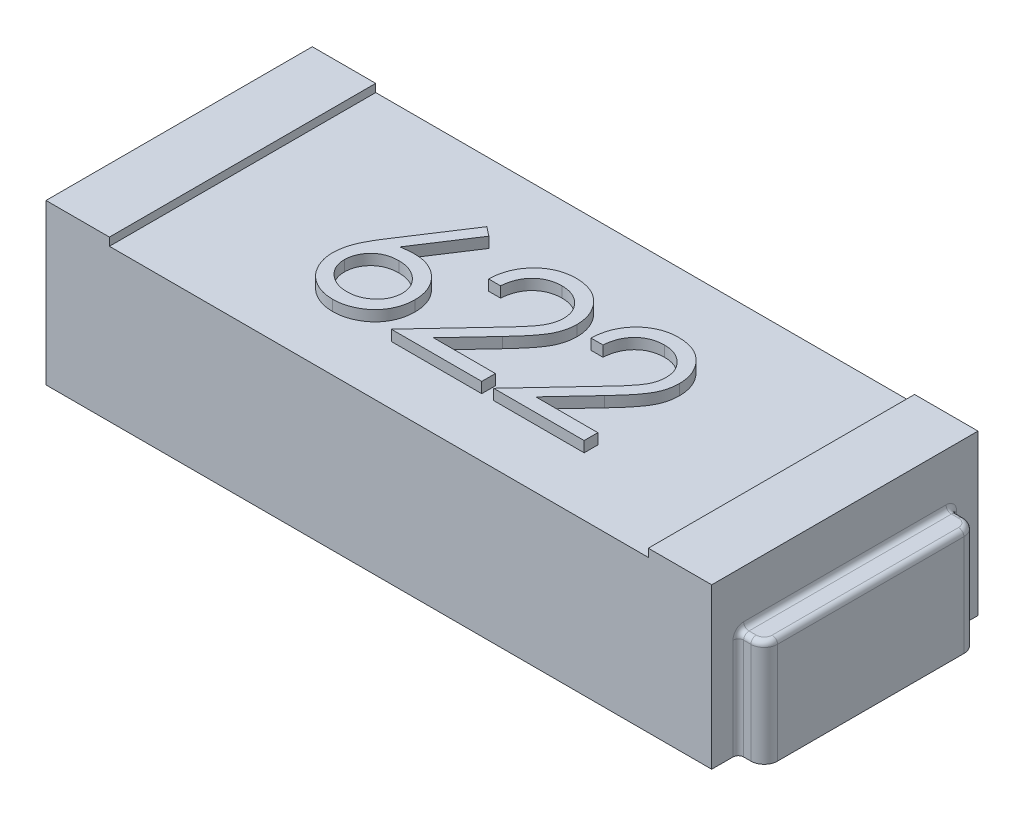
from build123d import *

# Parameters (mm, degrees)
ESQUISSE1_W             = 2.5
ESQUISSE1_H             = 1
BOSS_EXTRU_1_DEPTH      = 0.6
ESQUISSE2_W             = 2.023603034
ESQUISSE2_H             = 1
ENL_V_MAT_EXTRU_1_DEPTH = 0.03
BOSS_EXTRU_2_DEPTH      = 0.4
CONG_1_R                = 0.02
CONG_1_OF_SYM_TRIE2_R   = 0.02
BOSS_EXTRU_3_DEPTH      = 0.04


with BuildPart() as part:
    # Esquisse1 → Boss.-Extru.1 (new body)
    with BuildSketch(Plane(origin=(0, 0, 0), x_dir=(1, 0, 0), z_dir=(0, 1, 0))):
        Rectangle(ESQUISSE1_W, ESQUISSE1_H)
    extrude(amount=BOSS_EXTRU_1_DEPTH)

    # Esquisse2 → Enlèv. mat.-Extru.1 (cut)
    with BuildSketch(Plane(origin=(0, 0.6, 0), x_dir=(1, 0, 0), z_dir=(0, 1, 0))):
        Rectangle(ESQUISSE2_W, ESQUISSE2_H)
    extrude(amount=-ENL_V_MAT_EXTRU_1_DEPTH, mode=Mode.SUBTRACT)

    # Esquisse3 → Boss.-Extru.2 (add)
    with BuildSketch(Plane(origin=(0, 0, 0), x_dir=(1, 0, 0), z_dir=(0, 1, 0))):
        with BuildLine():
            Line((1.25, 0.4), (1.297141448, 0.4))
            ThreePointArc((1.297141448, 0.4), (1.332496787, 0.385355339), (1.347141448, 0.35))
            Line((1.347141448, 0.35), (1.347141448, -0.35))
            ThreePointArc((1.347141448, -0.35), (1.332496787, -0.385355339), (1.297141448, -0.4))
            Line((1.297141448, -0.4), (1.25, -0.4))
            Line((1.25, -0.4), (1.25, 0.4))
        make_face()
    boss_extru_2 = extrude(amount=BOSS_EXTRU_2_DEPTH)

    # Congé1
    cong_1_edges = [part.edges().sort_by_distance(p)[0] for p in [
        (1.25, 0.2, -0.4),
        (1.25, 0.2, 0.4),
        (1.25, 0.4, 0),
        (1.273570724, 0.4, 0.4),
        (1.332496787, 0.4, 0.385355339),
        (1.347141448, 0.4, 0),
        (1.332496787, 0.4, -0.385355339),
        (1.273570724, 0.4, -0.4),
    ]]
    fillet(cong_1_edges, radius=CONG_1_R)

    # Symétrie2: Boss.-Extru.2 across plane
    add(boss_extru_2.mirror(Plane(origin=(0, 0, 0), x_dir=(0, 0, 1), z_dir=(1, 0, 0))))

    # Congé1 of Symétrie2
    cong_1_of_sym_trie2_edges = [part.edges().sort_by_distance(p)[0] for p in [
        (-1.25, 0.2, -0.4),
        (-1.25, 0.2, 0.4),
        (-1.25, 0.4, 0),
        (-1.273570724, 0.4, 0.4),
        (-1.332496787, 0.4, 0.385355339),
        (-1.347141448, 0.4, 0),
        (-1.332496787, 0.4, -0.385355339),
        (-1.273570724, 0.4, -0.4),
    ]]
    fillet(cong_1_of_sym_trie2_edges, radius=CONG_1_OF_SYM_TRIE2_R)

    # Esquisse4 → Boss.-Extru.3 (add)
    # profile 1 of 3: a face of its own
    with BuildSketch(Plane(origin=(0, 0.57, 0), x_dir=(1, 0, 0), z_dir=(0, 1, 0))):
        with BuildLine():
            Line((0.275641026, 0.065854324), (0.230769231, 0.065854324))
            add(Edge.make_bspline(
                [(0.230769231, 0.065854324), (0.231061681, 0.071807307), (0.231636046, 0.08349881), (0.234325802, 0.100545082), (0.238174498, 0.116838625), (0.243616135, 0.132248612), (0.250374174, 0.146911299), (0.258478464, 0.160768444), (0.268077586, 0.173767185), (0.278964262, 0.18578702), (0.290788353, 0.196813816), (0.303546344, 0.206335994), (0.316952777, 0.214381375), (0.330966977, 0.221107267), (0.345747057, 0.226155816), (0.361158894, 0.229901765), (0.377270199, 0.232155528), (0.388247345, 0.232397784), (0.393830128, 0.23252099)],
                knots=[0, 0, 0, 0, 1.10065271, 2.161652631, 3.183658789, 4.190468796, 5.17591951, 6.163126047, 7.15150782, 8.156236427, 9.156009102, 10.134482811, 11.092018607, 12.041330605, 13.001268258, 13.972401359, 14.968799086, 16, 16, 16, 16], degree=3))
            add(Edge.make_bspline(
                [(0.393830128, 0.23252099), (0.39931271, 0.232392639), (0.410085788, 0.232140434), (0.425808933, 0.229974573), (0.440777118, 0.226582346), (0.454961085, 0.221823), (0.468247665, 0.215425225), (0.480736672, 0.207739862), (0.492576787, 0.198851315), (0.503234899, 0.188386485), (0.513021768, 0.177214715), (0.521464947, 0.165287872), (0.528695399, 0.152969403), (0.53472221, 0.140165374), (0.539158802, 0.126755227), (0.542527117, 0.112934198), (0.544431033, 0.098559225), (0.544723237, 0.088829717), (0.544871795, 0.08388317)],
                knots=[0, 0, 0, 0, 1.111607364, 2.184268762, 3.212621178, 4.221274766, 5.211760367, 6.196651075, 7.1921475, 8.207485113, 9.220403448, 10.201281604, 11.166441695, 12.114753415, 13.065576456, 14.026450734, 14.996634279, 16, 16, 16, 16], degree=3))
            add(Edge.make_bspline(
                [(0.544871795, 0.08388317), (0.5446299, 0.076919193), (0.544150356, 0.063113449), (0.540048302, 0.042825611), (0.533641657, 0.023169408), (0.525927749, 0.007349794), (0.518145972, -0.005397848), (0.511133471, -0.015893378), (0.502924212, -0.027194159), (0.493398712, -0.03926235), (0.482754016, -0.052192479), (0.470893707, -0.065976736), (0.45773321, -0.080472703), (0.448496281, -0.090373503), (0.443709936, -0.09550385)],
                knots=[0, 0, 0, 0, 1.184426356, 2.348067706, 3.509069118, 4.696110526, 5.333549288, 6.050745305, 6.844228056, 7.710549037, 8.667450064, 9.695053472, 10.805634456, 12, 12, 12, 12], degree=3))
            Line((0.443709936, -0.09550385), (0.318609776, -0.229017471))
            Line((0.318609776, -0.229017471), (0.551282051, -0.229017471))
            Line((0.551282051, -0.229017471), (0.551282051, -0.280299523))
            Line((0.551282051, -0.280299523), (0.211538462, -0.280299523))
            Line((0.211538462, -0.280299523), (0.405448718, -0.073368433))
            add(Edge.make_bspline(
                [(0.405448718, -0.073368433), (0.410169845, -0.068440103), (0.419238163, -0.058973791), (0.432064245, -0.045153368), (0.443584101, -0.032332005), (0.4538723, -0.020533927), (0.462705658, -0.00958656), (0.470544548, 0.000155541), (0.476825347, 0.009120462), (0.483641832, 0.019511978), (0.490243829, 0.032199452), (0.495917023, 0.047704265), (0.499376287, 0.063665301), (0.499791263, 0.074451306), (0.5, 0.079876759)],
                knots=[0, 0, 0, 0, 1.329631726, 2.553950428, 3.673215718, 4.687767853, 5.603093632, 6.413772471, 7.123043292, 7.734684054, 8.834405432, 9.900288307, 10.943827018, 12, 12, 12, 12], degree=3))
            add(Edge.make_bspline(
                [(0.5, 0.079876759), (0.49990918, 0.083288388), (0.49973019, 0.090012052), (0.498150519, 0.099870018), (0.495763304, 0.109379277), (0.492342553, 0.11856908), (0.487827304, 0.12734703), (0.482331107, 0.135723813), (0.47598967, 0.143822236), (0.468653774, 0.151415565), (0.460594985, 0.158370023), (0.452081521, 0.164530606), (0.443074363, 0.169679051), (0.433611489, 0.17389955), (0.423719279, 0.177210319), (0.413378601, 0.179504402), (0.402618027, 0.180944757), (0.395270385, 0.181139638), (0.391526442, 0.181238939)],
                knots=[0, 0, 0, 0, 0.991446411, 1.95395049, 2.89581595, 3.838931463, 4.798493298, 5.75982156, 6.748411868, 7.785213223, 8.824556874, 9.840280684, 10.836137867, 11.835679398, 12.848801643, 13.863922112, 14.911575587, 16, 16, 16, 16], degree=3))
            add(Edge.make_bspline(
                [(0.391526442, 0.181238939), (0.387616323, 0.181136791), (0.379937495, 0.180936191), (0.368663348, 0.179532953), (0.357908237, 0.177112119), (0.347645108, 0.173801165), (0.337856595, 0.169592801), (0.328590303, 0.164351123), (0.319867034, 0.158096338), (0.311670387, 0.15100483), (0.30411839, 0.143109459), (0.297483122, 0.134308036), (0.291685406, 0.124761262), (0.286626944, 0.114494898), (0.282518988, 0.103415786), (0.279379967, 0.091563257), (0.276896132, 0.078988774), (0.276066343, 0.07030519), (0.275641026, 0.065854324)],
                knots=[0, 0, 0, 0, 1.031018746, 2.02475058, 2.990194455, 3.934040569, 4.864654155, 5.795059489, 6.735614925, 7.690564532, 8.649604399, 9.611025574, 10.590972636, 11.591080095, 12.624614302, 13.701020113, 14.821632451, 16, 16, 16, 16], degree=3))
        make_face()
    # profile 2 of 3: a face of its own
    with BuildSketch(Plane(origin=(0, 0.57, 0), x_dir=(1, 0, 0), z_dir=(0, 1, 0))):
        with BuildLine():
            Line((-0.108974359, 0.065854324), (-0.153846154, 0.065854324))
            add(Edge.make_bspline(
                [(-0.153846154, 0.065854324), (-0.153553703, 0.071807307), (-0.152979339, 0.08349881), (-0.150289583, 0.100545082), (-0.146440886, 0.116838625), (-0.14099925, 0.132248612), (-0.13424121, 0.146911299), (-0.126136921, 0.160768444), (-0.116537799, 0.173767185), (-0.105651123, 0.18578702), (-0.093827032, 0.196813816), (-0.08106904, 0.206335994), (-0.067662608, 0.214381375), (-0.053648408, 0.221107267), (-0.038868327, 0.226155816), (-0.023456491, 0.229901765), (-0.007345185, 0.232155528), (0.003631961, 0.232397784), (0.009214744, 0.23252099)],
                knots=[0, 0, 0, 0, 1.10065271, 2.161652631, 3.183658789, 4.190468796, 5.17591951, 6.163126047, 7.15150782, 8.156236427, 9.156009102, 10.134482811, 11.092018607, 12.041330605, 13.001268258, 13.972401359, 14.968799086, 16, 16, 16, 16], degree=3))
            add(Edge.make_bspline(
                [(0.009214744, 0.23252099), (0.014697326, 0.232392639), (0.025470403, 0.232140434), (0.041193548, 0.229974573), (0.056161733, 0.226582346), (0.0703457, 0.221823), (0.083632281, 0.215425225), (0.096121287, 0.207739862), (0.107961403, 0.198851315), (0.118619515, 0.188386485), (0.128406383, 0.177214715), (0.136849562, 0.165287872), (0.144080014, 0.152969403), (0.150106826, 0.140165374), (0.154543417, 0.126755227), (0.157911733, 0.112934198), (0.159815649, 0.098559225), (0.160107852, 0.088829717), (0.16025641, 0.08388317)],
                knots=[0, 0, 0, 0, 1.111607364, 2.184268762, 3.212621178, 4.221274766, 5.211760367, 6.196651075, 7.1921475, 8.207485113, 9.220403448, 10.201281604, 11.166441695, 12.114753415, 13.065576456, 14.026450734, 14.996634279, 16, 16, 16, 16], degree=3))
            add(Edge.make_bspline(
                [(0.16025641, 0.08388317), (0.160014516, 0.076919193), (0.159534971, 0.063113449), (0.155432917, 0.042825611), (0.149026273, 0.023169408), (0.141312365, 0.007349794), (0.133530587, -0.005397848), (0.126518086, -0.015893378), (0.118308827, -0.027194159), (0.108783327, -0.03926235), (0.098138631, -0.052192479), (0.086278322, -0.065976736), (0.073117825, -0.080472703), (0.063880896, -0.090373503), (0.059094551, -0.09550385)],
                knots=[0, 0, 0, 0, 1.184426356, 2.348067706, 3.509069118, 4.696110526, 5.333549288, 6.050745305, 6.844228056, 7.710549037, 8.667450064, 9.695053472, 10.805634456, 12, 12, 12, 12], degree=3))
            Line((0.059094551, -0.09550385), (-0.066005609, -0.229017471))
            Line((-0.066005609, -0.229017471), (0.166666667, -0.229017471))
            Line((0.166666667, -0.229017471), (0.166666667, -0.280299523))
            Line((0.166666667, -0.280299523), (-0.173076923, -0.280299523))
            Line((-0.173076923, -0.280299523), (0.020833333, -0.073368433))
            add(Edge.make_bspline(
                [(0.020833333, -0.073368433), (0.02555446, -0.068440103), (0.034622778, -0.058973791), (0.047448861, -0.045153368), (0.058968716, -0.032332005), (0.069256915, -0.020533927), (0.078090273, -0.00958656), (0.085929163, 0.000155541), (0.092209962, 0.009120462), (0.099026447, 0.019511978), (0.105628444, 0.032199452), (0.111301638, 0.047704265), (0.114760902, 0.063665301), (0.115175879, 0.074451306), (0.115384615, 0.079876759)],
                knots=[0, 0, 0, 0, 1.329631726, 2.553950428, 3.673215718, 4.687767853, 5.603093632, 6.413772471, 7.123043292, 7.734684054, 8.834405432, 9.900288307, 10.943827018, 12, 12, 12, 12], degree=3))
            add(Edge.make_bspline(
                [(0.115384615, 0.079876759), (0.115293795, 0.083288388), (0.115114806, 0.090012052), (0.113535135, 0.099870018), (0.111147919, 0.109379277), (0.107727168, 0.11856908), (0.10321192, 0.12734703), (0.097715723, 0.135723813), (0.091374285, 0.143822236), (0.084038389, 0.151415565), (0.075979601, 0.158370023), (0.067466137, 0.164530606), (0.058458979, 0.169679051), (0.048996104, 0.17389955), (0.039103894, 0.177210319), (0.028763216, 0.179504402), (0.018002643, 0.180944757), (0.010655, 0.181139638), (0.006911058, 0.181238939)],
                knots=[0, 0, 0, 0, 0.991446411, 1.95395049, 2.89581595, 3.838931463, 4.798493298, 5.75982156, 6.748411868, 7.785213223, 8.824556874, 9.840280684, 10.836137867, 11.835679398, 12.848801643, 13.863922112, 14.911575587, 16, 16, 16, 16], degree=3))
            add(Edge.make_bspline(
                [(0.006911058, 0.181238939), (0.003000939, 0.181136791), (-0.004677889, 0.180936191), (-0.015952037, 0.179532953), (-0.026707148, 0.177112119), (-0.036970277, 0.173801165), (-0.046758789, 0.169592801), (-0.056025081, 0.164351123), (-0.064748351, 0.158096338), (-0.072944997, 0.15100483), (-0.080496994, 0.143109459), (-0.087132262, 0.134308036), (-0.092929979, 0.124761262), (-0.097988441, 0.114494898), (-0.102096396, 0.103415786), (-0.105235418, 0.091563257), (-0.107719253, 0.078988774), (-0.108549042, 0.07030519), (-0.108974359, 0.065854324)],
                knots=[0, 0, 0, 0, 1.031018746, 2.02475058, 2.990194455, 3.934040569, 4.864654155, 5.795059489, 6.735614925, 7.690564532, 8.649604399, 9.611025574, 10.590972636, 11.591080095, 12.624614302, 13.701020113, 14.821632451, 16, 16, 16, 16], degree=3))
        make_face()
    # profile 3 of 3: a face of its own
    with BuildSketch(Plane(origin=(0, 0.57, 0), x_dir=(1, 0, 0), z_dir=(0, 1, 0))):
        with BuildLine():
            Line((-0.326923077, 0.23252099), (-0.292367788, 0.205377561))
            Line((-0.292367788, 0.205377561), (-0.424479167, 0.003354324))
            add(Edge.make_bspline(
                [(-0.424479167, 0.003354324), (-0.415683413, 0.004756304), (-0.3985263, 0.007491024), (-0.381159743, 0.007942159), (-0.372696314, 0.008162016)],
                knots=[0, 0, 0, 0, 1.025318673, 2, 2, 2, 2], degree=3))
            add(Edge.make_bspline(
                [(-0.372696314, 0.008162016), (-0.367614529, 0.008025428), (-0.357611186, 0.00775656), (-0.3429245, 0.005687439), (-0.328811795, 0.002426708), (-0.315331565, -0.002326471), (-0.302435424, -0.008398236), (-0.290049368, -0.015675217), (-0.278406223, -0.024533172), (-0.267356055, -0.034428165), (-0.257323612, -0.045387735), (-0.248441319, -0.057016497), (-0.240980349, -0.069302337), (-0.234926931, -0.082239032), (-0.230226234, -0.095806641), (-0.226799428, -0.109987804), (-0.224773772, -0.124792299), (-0.224498702, -0.13486061), (-0.224358974, -0.139975003)],
                knots=[0, 0, 0, 0, 1.04369286, 2.054478336, 3.041073146, 4.015093852, 4.984733326, 5.965804835, 6.960378782, 7.985147595, 9.009457201, 10.008161701, 10.986880575, 11.956520048, 12.937015923, 13.931873656, 14.949455224, 16, 16, 16, 16], degree=3))
            add(Edge.make_bspline(
                [(-0.224358974, -0.139975003), (-0.224562275, -0.146972104), (-0.224962323, -0.160740742), (-0.228948579, -0.180794557), (-0.235142814, -0.199899202), (-0.243996747, -0.217749655), (-0.25499423, -0.234321451), (-0.268405315, -0.249005089), (-0.283754385, -0.262100808), (-0.301109641, -0.273051754), (-0.319787208, -0.281995047), (-0.339408922, -0.288418653), (-0.359784228, -0.292373434), (-0.373613458, -0.292869235), (-0.380608974, -0.293120035)],
                knots=[0, 0, 0, 0, 1.031375318, 2.029502543, 3.004789286, 3.987476834, 4.960371455, 5.9300674, 6.912260825, 7.929083631, 8.949397511, 9.960523116, 10.96833055, 12, 12, 12, 12], degree=3))
            add(Edge.make_bspline(
                [(-0.380608974, -0.293120035), (-0.387337074, -0.29290172), (-0.400664263, -0.292469276), (-0.420268948, -0.288616999), (-0.439106522, -0.282373128), (-0.457045005, -0.273771088), (-0.473662235, -0.262905676), (-0.488528754, -0.24982535), (-0.501570437, -0.234809713), (-0.512423954, -0.217861092), (-0.521032344, -0.19964824), (-0.527488048, -0.180657218), (-0.53125894, -0.160957221), (-0.531785876, -0.147602772), (-0.532051282, -0.140876446)],
                knots=[0, 0, 0, 0, 1.012016664, 2.004627821, 2.994792927, 3.992885782, 4.990978636, 5.973936114, 6.964471063, 7.975201453, 8.993600317, 9.990122807, 10.98767138, 12, 12, 12, 12], degree=3))
            add(Edge.make_bspline(
                [(-0.532051282, -0.140876446), (-0.531882504, -0.13572722), (-0.531537892, -0.125213484), (-0.529131693, -0.109290051), (-0.525265294, -0.092997039), (-0.520935259, -0.079175012), (-0.516360172, -0.067851937), (-0.512552666, -0.058722867), (-0.507813524, -0.049328428), (-0.502760184, -0.03934648), (-0.496937774, -0.029034275), (-0.490606967, -0.018219465), (-0.483592731, -0.007074047), (-0.478675565, 0.000489409), (-0.476161859, 0.004355926)],
                knots=[0, 0, 0, 0, 1.173818275, 2.396712641, 3.66331629, 4.989737886, 5.693666774, 6.447286557, 7.243889047, 8.091586357, 8.998013824, 9.943181721, 10.948533338, 12, 12, 12, 12], degree=3))
            Line((-0.476161859, 0.004355926), (-0.326923077, 0.23252099))
        make_face()
        with BuildLine():
            add(Edge.make_bspline(
                [(-0.382111378, -0.043120035), (-0.38592027, -0.043231185), (-0.393360143, -0.043448291), (-0.404275488, -0.044709041), (-0.414605953, -0.047083194), (-0.4244884, -0.050106955), (-0.433738072, -0.054264535), (-0.442422192, -0.059314792), (-0.450574342, -0.065260675), (-0.458109135, -0.072017948), (-0.464940516, -0.079416238), (-0.470823535, -0.087340456), (-0.475898163, -0.095599628), (-0.480024137, -0.104262762), (-0.483237005, -0.113326548), (-0.485561041, -0.122749298), (-0.486854434, -0.132594199), (-0.48706961, -0.13927027), (-0.487179487, -0.14267933)],
                knots=[0, 0, 0, 0, 1.129588631, 2.206414736, 3.251139165, 4.268635594, 5.265702196, 6.250456724, 7.242448911, 8.251968645, 9.246821453, 10.222880186, 11.173611482, 12.116736599, 13.062300278, 14.020270554, 14.989073742, 16, 16, 16, 16], degree=3))
            add(Edge.make_bspline(
                [(-0.487179487, -0.14267933), (-0.487090007, -0.146057899), (-0.48691455, -0.152682769), (-0.485321361, -0.162445509), (-0.482887778, -0.171840496), (-0.479267721, -0.180819296), (-0.474949594, -0.18951877), (-0.469248834, -0.19762381), (-0.46293215, -0.205626677), (-0.455381588, -0.212912602), (-0.447278251, -0.21969212), (-0.438620936, -0.22561787), (-0.429598085, -0.230687324), (-0.420087881, -0.234660337), (-0.410225255, -0.23792095), (-0.399928033, -0.240215447), (-0.389189054, -0.241512665), (-0.381914491, -0.241728121), (-0.378205128, -0.241837984)],
                knots=[0, 0, 0, 0, 0.989467248, 1.94019797, 2.891935182, 3.827694429, 4.772920941, 5.730924762, 6.725747692, 7.756678648, 8.79901574, 9.819492441, 10.826891316, 11.826466727, 12.835195252, 13.867842842, 14.912794438, 16, 16, 16, 16], degree=3))
            add(Edge.make_bspline(
                [(-0.378205128, -0.241837984), (-0.374495771, -0.241728113), (-0.367221221, -0.241512639), (-0.356482155, -0.240215544), (-0.346185252, -0.237920594), (-0.336321465, -0.234661627), (-0.326815547, -0.23068254), (-0.317800586, -0.225649409), (-0.309225144, -0.219655677), (-0.301116487, -0.212924188), (-0.293597353, -0.205585209), (-0.287129171, -0.197695248), (-0.281602994, -0.189453263), (-0.277112396, -0.180853565), (-0.273532212, -0.171835067), (-0.271086288, -0.162446963), (-0.269496389, -0.152682388), (-0.26932048, -0.14605777), (-0.269230769, -0.14267933)],
                knots=[0, 0, 0, 0, 1.087397944, 2.132534446, 3.165364764, 4.174271784, 5.174024072, 6.181601208, 7.194203697, 8.236725232, 9.267838612, 10.269026844, 11.221737037, 12.171628256, 13.107553087, 14.05945871, 15.010357665, 16, 16, 16, 16], degree=3))
            add(Edge.make_bspline(
                [(-0.269230769, -0.14267933), (-0.269309383, -0.139265823), (-0.269463675, -0.132566218), (-0.27120881, -0.122753702), (-0.273629149, -0.113278672), (-0.277283868, -0.104200679), (-0.282031946, -0.095555547), (-0.28781529, -0.087299604), (-0.294505657, -0.079369554), (-0.302233877, -0.072003439), (-0.310646768, -0.065268142), (-0.319591851, -0.059322491), (-0.328950133, -0.054304637), (-0.338712125, -0.050117908), (-0.34898968, -0.047096555), (-0.359616871, -0.04471752), (-0.37072962, -0.043451518), (-0.378269135, -0.043231937), (-0.382111378, -0.043120035)],
                knots=[0, 0, 0, 0, 0.978206639, 1.919901502, 2.851605144, 3.780102724, 4.718870031, 5.675451981, 6.667674623, 7.690630536, 8.733308323, 9.756129687, 10.767539656, 11.776269907, 12.797430371, 13.836405707, 14.897401972, 16, 16, 16, 16], degree=3))
        make_face(mode=Mode.SUBTRACT)
    extrude(amount=BOSS_EXTRU_3_DEPTH)


solid = part.part
